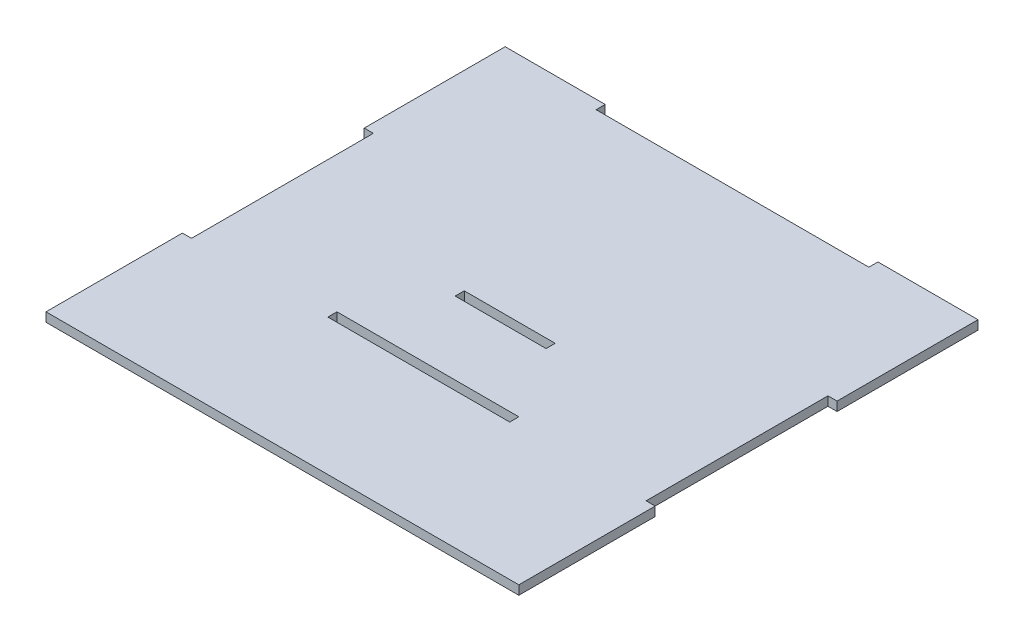
from build123d import *

# Parameters (mm, degrees)
SKETCH_1_W      = 40
SKETCH_1_H      = 2
SKETCH_1_W_2    = 20
EXTRUDE_2_DEPTH = 2


with BuildPart() as part:
    # 草图1 → 凸台-拉伸2 (new body)
    with BuildSketch(Plane(origin=(0, 0, 0), x_dir=(1, 0, 0), z_dir=(0, 1, 0))):
        Polygon((0, 30), (0, 0), (104, 0), (104, 30), (102, 30), (102, 70), (104, 70), (104, 101), (82, 101), (82, 99), (22, 99), (22, 101), (0, 101), (0, 70), (2, 70), (2, 30), align=None)
        with Locations((52, 31)):
            Rectangle(SKETCH_1_W, SKETCH_1_H, mode=Mode.SUBTRACT)
        with Locations((52, 49)):
            Rectangle(SKETCH_1_W_2, SKETCH_1_H, mode=Mode.SUBTRACT)
    extrude(amount=EXTRUDE_2_DEPTH)


solid = part.part
